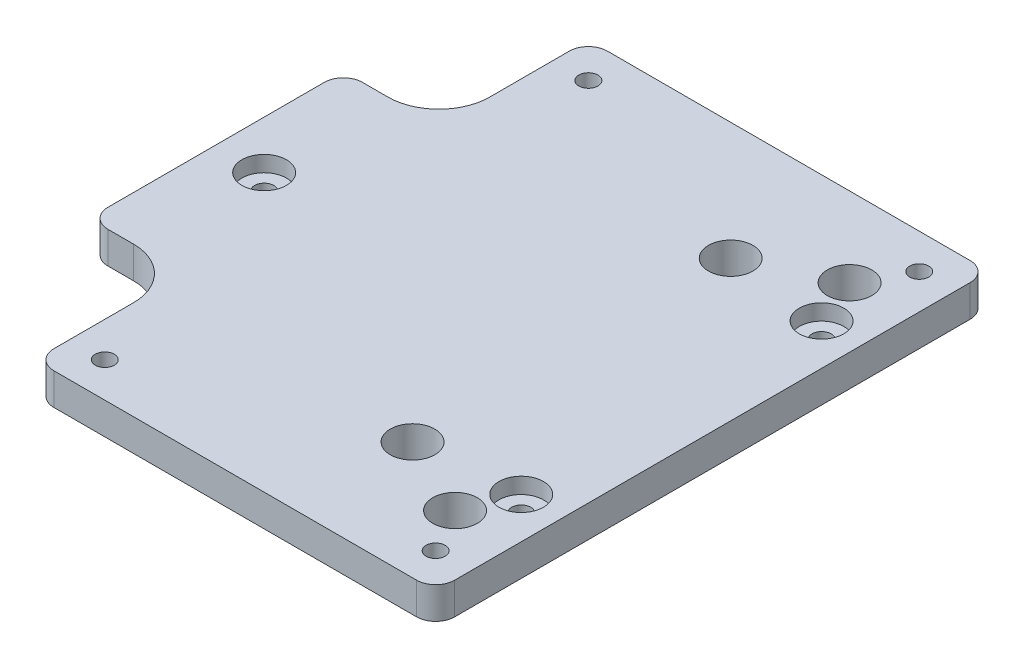
from build123d import *

# Parameters (mm, degrees)
SKETCH1_R           = 1.5
SKETCH1_R_2         = 3.5
BOSS_EXTRUDE1_DEPTH = 5
FILLET1_R           = 3
FILLET2_R           = 8
SKETCH2_R           = 3.5
CUT_EXTRUDE1_DEPTH  = 2.5
CUT_EXTRUDE2_DEPTH  = 2


with BuildPart() as part:
    # Sketch1 → Boss-Extrude1 (new body)
    with BuildSketch(Plane(origin=(0, 0, 0), x_dir=(1, 0, 0), z_dir=(0, 1, 0))):
        Polygon((-34, -43.5), (-34, 43.5), (-97, 43.5), (-97, 20), (-112, 20), (-112, -20), (-97, -20), (-97, -43.5), align=None)
        with Locations(Location((-104.45, 0, 0), (0, 0, 270))):
            Circle(SKETCH1_R, mode=Mode.SUBTRACT)
        with Locations(Location((-43.45, 31, 0), (0, 0, 270))):
            Circle(SKETCH1_R_2, mode=Mode.SUBTRACT)
        with Locations(Location((-56.13, 25, 0), (0, 0, 270))):
            Circle(SKETCH1_R_2, mode=Mode.SUBTRACT)
        with Locations(Location((-40.45, 23.6, 0), (0, 0, 270))):
            Circle(SKETCH1_R, mode=Mode.SUBTRACT)
        with Locations(Location((-40.45, -23.6, 0), (0, 0, 270))):
            Circle(SKETCH1_R, mode=Mode.SUBTRACT)
        with Locations(Location((-56.13, -25, 0), (0, 0, 270))):
            Circle(SKETCH1_R_2, mode=Mode.SUBTRACT)
        with Locations(Location((-43.45, -31, 0), (0, 0, 270))):
            Circle(SKETCH1_R_2, mode=Mode.SUBTRACT)
        with Locations(Location((-39.5, 38, 0), (0, 0, 270))):
            Circle(SKETCH1_R, mode=Mode.SUBTRACT)
        with Locations(Location((-91.5, 38, 0), (0, 0, 270))):
            Circle(SKETCH1_R, mode=Mode.SUBTRACT)
        with Locations(Location((-91.5, -38, 0), (0, 0, 270))):
            Circle(SKETCH1_R, mode=Mode.SUBTRACT)
        with Locations(Location((-39.5, -38, 0), (0, 0, 270))):
            Circle(SKETCH1_R, mode=Mode.SUBTRACT)
    extrude(amount=BOSS_EXTRUDE1_DEPTH)

    # Fillet1
    fillet1_edges = [part.edges().sort_by_distance(p)[0] for p in [
        (-97, 2.5, 43.5),
        (-112, 2.5, 20),
        (-112, 2.5, -20),
        (-97, 2.5, -43.5),
        (-34, 2.5, -43.5),
        (-34, 2.5, 43.5),
    ]]
    fillet(fillet1_edges, radius=FILLET1_R)

    # Fillet2
    fillet2_edges = [part.edges().sort_by_distance(p)[0] for p in [
        (-97, 2.5, 20),
        (-97, 2.5, -20),
    ]]
    fillet(fillet2_edges, radius=FILLET2_R)

    # Sketch2 → Cut-Extrude1 (cut)
    with BuildSketch(Plane(origin=(0, 5, 0), x_dir=(1, 0, 0), z_dir=(0, 1, 0))):
        with Locations(Location((-40.45, -23.6, 0), (0, 0, 270))):
            Circle(SKETCH2_R)
        with Locations(Location((-40.45, 23.6, 0), (0, 0, 270))):
            Circle(SKETCH2_R)
        with Locations(Location((-104.45, 0, 0), (0, 0, 270))):
            Circle(SKETCH2_R)
    extrude(amount=-CUT_EXTRUDE1_DEPTH, mode=Mode.SUBTRACT)

    # Sketch3 → Cut-Extrude2 (cut)
    with BuildSketch(Plane.XZ):
        Polygon((-37.897853003, 35.225), (-36.295706006, 38), (-37.897853003, 40.775), (-41.102146997, 40.775), (-42.704293994, 38), (-41.102146997, 35.225), align=None)
        Polygon((-89.897853003, 35.225), (-88.295706006, 38), (-89.897853003, 40.775), (-93.102146997, 40.775), (-94.704293994, 38), (-93.102146997, 35.225), align=None)
        Polygon((-89.91228676, -35.25), (-93.08771324, -35.25), (-94.675426481, -38), (-93.08771324, -40.75), (-89.91228676, -40.75), (-88.324573519, -38), align=None)
        Polygon((-37.91228676, -40.75), (-36.324573519, -38), (-37.91228676, -35.25), (-41.08771324, -35.25), (-42.675426481, -38), (-41.08771324, -40.75), align=None)
    extrude(amount=-CUT_EXTRUDE2_DEPTH, mode=Mode.SUBTRACT)


solid = part.part
